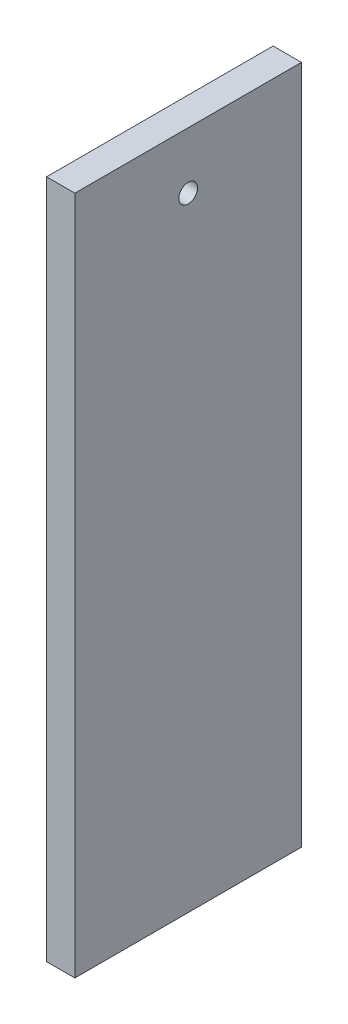
from build123d import *

# Parameters (mm, degrees)
SKETCH1_W           = 40
SKETCH1_H           = 120
BOSS_EXTRUDE1_DEPTH = 5
CUT_EXTRUDE1_DEPTH  = 5


with BuildPart() as part:
    # Sketch1 → Boss-Extrude1 (new body)
    with BuildSketch(Plane(origin=(0, 0, 0), x_dir=(0, 0, -1), z_dir=(1, 0, 0))):
        with Locations((-20, 60)):
            Rectangle(SKETCH1_W, SKETCH1_H)
    extrude(amount=BOSS_EXTRUDE1_DEPTH)

    # Sketch2 → Cut-Extrude1 (cut)
    with BuildSketch(Plane(origin=(5, 0, 0), x_dir=(0, 0, -1), z_dir=(1, 0, 0))):
        with BuildLine():
            ThreePointArc((-18.35, 110), (-18.833273811, 111.166726189), (-20, 111.65))
            Line((-20, 111.65), (-20, 108.35))
            ThreePointArc((-20, 108.35), (-18.833273811, 108.833273811), (-18.35, 110))
        make_face()
        with BuildLine():
            Line((-20, 108.35), (-20, 111.65))
            ThreePointArc((-20, 111.65), (-21.65, 110), (-20, 108.35))
        make_face()
    extrude(amount=-CUT_EXTRUDE1_DEPTH, mode=Mode.SUBTRACT)


solid = part.part
